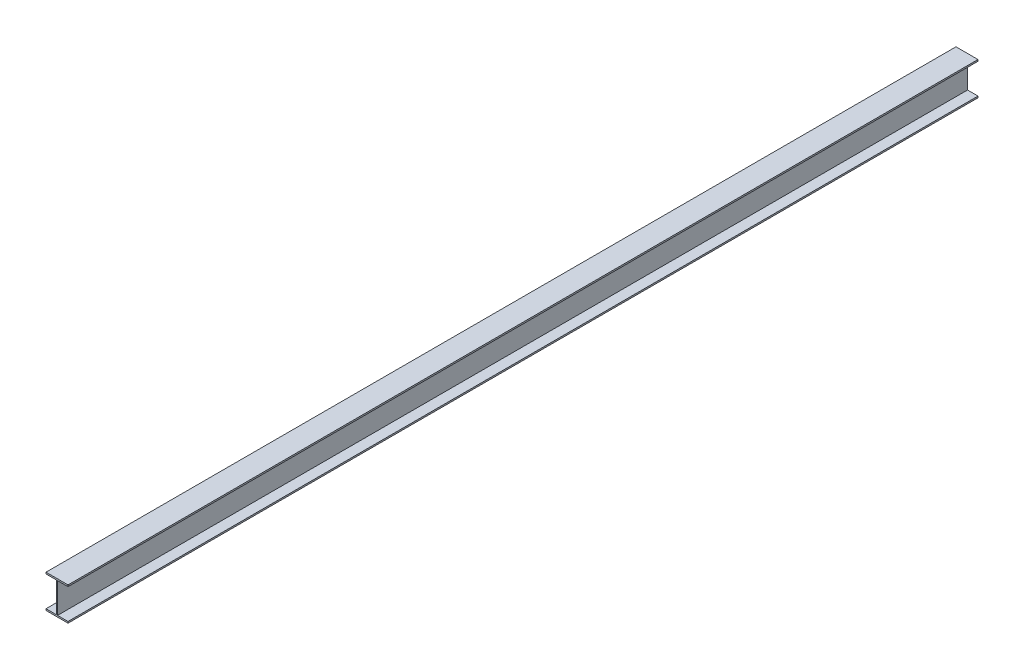
from build123d import *

# Parameters (mm, degrees)
BOSS_EXTRUDE1_DEPTH = 4200


with BuildPart() as part:
    # Sketch1 → Boss-Extrude1 (new body)
    with BuildSketch(Plane.XY):
        Polygon((0, -0.000240533), (101.6, -0.000240533), (101.6, -7.112240533), (53.408035714, -7.112240533), (53.408035714, -146.050240533), (101.6, -146.050240533), (101.6, -153.162240533), (0, -153.162240533), (0, -146.050240533), (47.566035714, -146.050240533), (47.566035714, -7.112240533), (0, -7.112240533), align=None)
    extrude(amount=BOSS_EXTRUDE1_DEPTH)


solid = part.part
